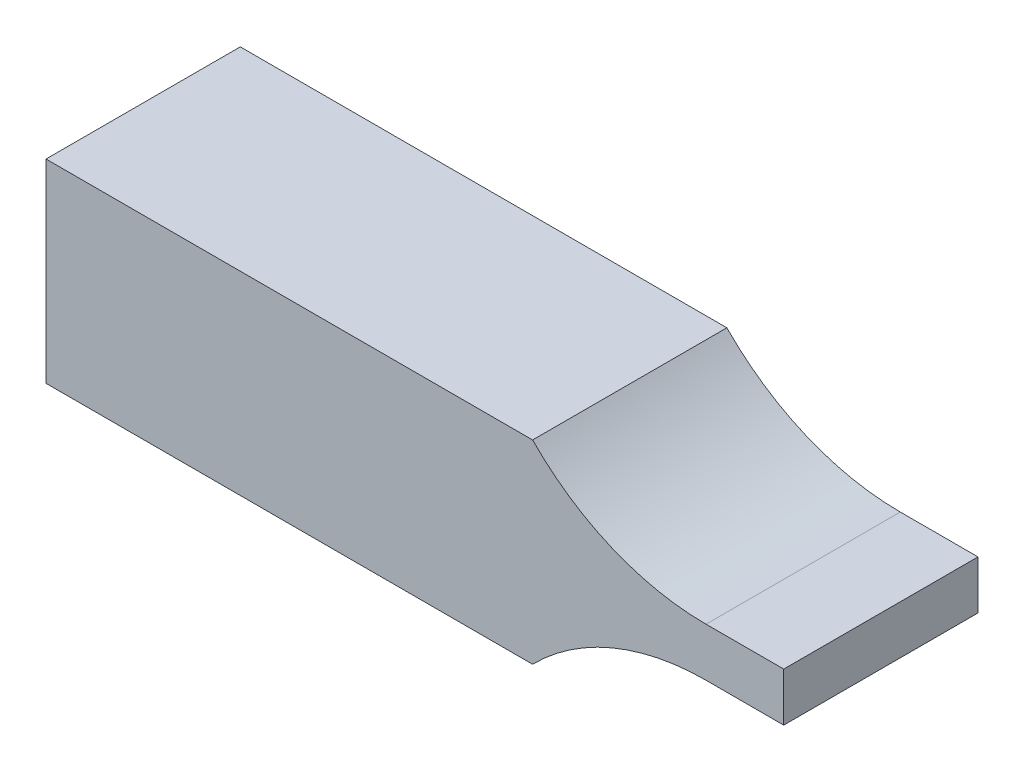
from build123d import *

# Parameters (mm, degrees)
BOSS_EXTRUDE1_DEPTH = 10


with BuildPart() as part:
    # Sketch1 → Boss-Extrude1 (new, symmetric)
    with BuildSketch(Plane.XY):
        with BuildLine():
            Line((4.464127796, -6.549926282), (-45.630662582, -6.549926282))
            Line((-45.630662582, -6.549926282), (-45.630662582, -26.549926282))
            Line((-45.630662582, -26.549926282), (4.464127796, -26.549926282))
            ThreePointArc((4.464127796, -26.549926282), (12.635240502, -21.001065139), (22.317698867, -19.049926282))
            Line((22.317698867, -19.049926282), (30.317698867, -19.049926282))
            Line((30.317698867, -19.049926282), (30.317698867, -14.049926282))
            Line((30.317698867, -14.049926282), (22.317698867, -14.049926282))
            ThreePointArc((22.317698867, -14.049926282), (12.635240502, -12.098787426), (4.464127796, -6.549926282))
        make_face()
    extrude(amount=BOSS_EXTRUDE1_DEPTH, both=True)


solid = part.part
